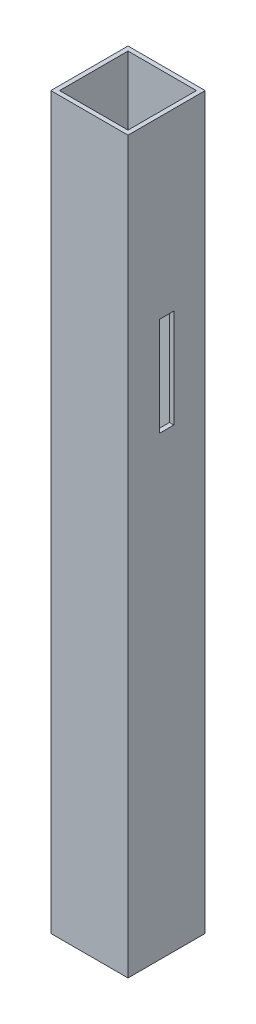
from build123d import *

# Parameters (mm, degrees)
SKETCH1_W           = 34.925
SKETCH1_H           = 34.925
SKETCH1_W_2         = 30.9626
SKETCH1_H_2         = 30.9626
BOSS_EXTRUDE1_DEPTH = 165.1
SKETCH2_W           = 6.550000108
SKETCH2_H           = 44.650000108
CUT_EXTRUDE1_DEPTH  = 170.654662569


with BuildPart() as part:
    # Sketch1 → Boss-Extrude1 (new, symmetric)
    with BuildSketch(Plane(origin=(0, 0, 0), x_dir=(1, 0, 0), z_dir=(0, 1, 0))):
        Rectangle(SKETCH1_W, SKETCH1_H)
        Rectangle(SKETCH1_W_2, SKETCH1_H_2, mode=Mode.SUBTRACT)
    extrude(amount=BOSS_EXTRUDE1_DEPTH, both=True)

    # Sketch2 → Cut-Extrude1 (cut, through all)
    with BuildSketch(Plane(origin=(17.4625, 0, 0), x_dir=(0, 0, -1), z_dir=(1, 0, 0))):
        with Locations((0, 63.5)):
            Rectangle(SKETCH2_W, SKETCH2_H)
    extrude(amount=-CUT_EXTRUDE1_DEPTH, mode=Mode.SUBTRACT)


solid = part.part
